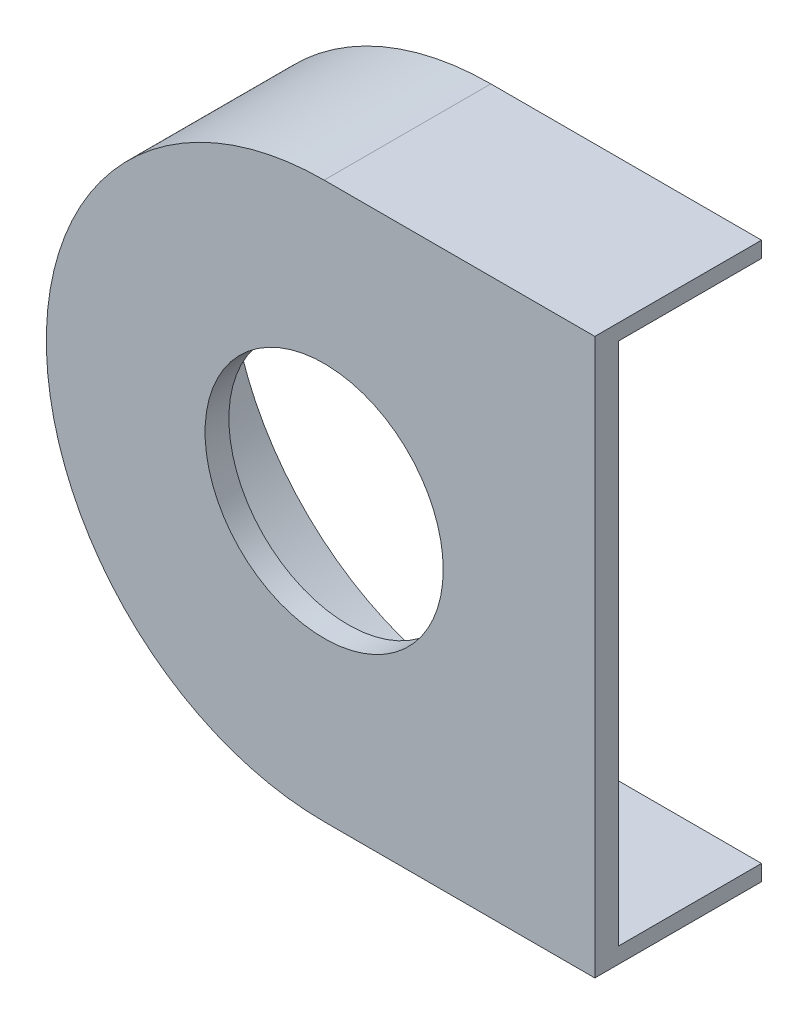
from build123d import *

# Parameters (mm, degrees)
SCHIZZO1_R                   = 7.5
ESTRUSIONE_ESTRUSIONE1_DEPTH = 1.5
ESTRUSIONE_ESTRUSIONE2_START = 9
ESTRUSIONE_ESTRUSIONE2_DEPTH = 9


with BuildPart() as part:
    # Schizzo1 → Estrusione-Estrusione1 (new body)
    with BuildSketch(Plane.XY):
        with BuildLine():
            Line((17.05, -17.5), (0, -17.5))
            ThreePointArc((0, -17.5), (-17.5, 0), (0, 17.5))
            Line((0, 17.5), (17.05, 17.5))
            Line((17.05, 17.5), (17.05, -17.5))
        make_face()
        Circle(SCHIZZO1_R, mode=Mode.SUBTRACT)
    extrude(amount=ESTRUSIONE_ESTRUSIONE1_DEPTH)

    # Schizzo2 → Estrusione-Estrusione2 (add)
    with BuildSketch(Plane(origin=(0, 0, 0), x_dir=(-1, 0, 0), z_dir=(0, 0, -1)).offset(ESTRUSIONE_ESTRUSIONE2_START)):
        with BuildLine():
            Line((-17.05, 17.5), (0, 17.5))
            ThreePointArc((0, 17.5), (17.5, 0), (0, -17.5))
            Line((0, -17.5), (-17.05, -17.5))
            Line((-17.05, -17.5), (-17.05, -16.5))
            Line((-17.05, -16.5), (0, -16.5))
            ThreePointArc((0, -16.5), (16.5, 0), (0, 16.5))
            Line((0, 16.5), (-17.05, 16.5))
            Line((-17.05, 16.5), (-17.05, 17.5))
        make_face()
    extrude(amount=-ESTRUSIONE_ESTRUSIONE2_DEPTH)


solid = part.part
